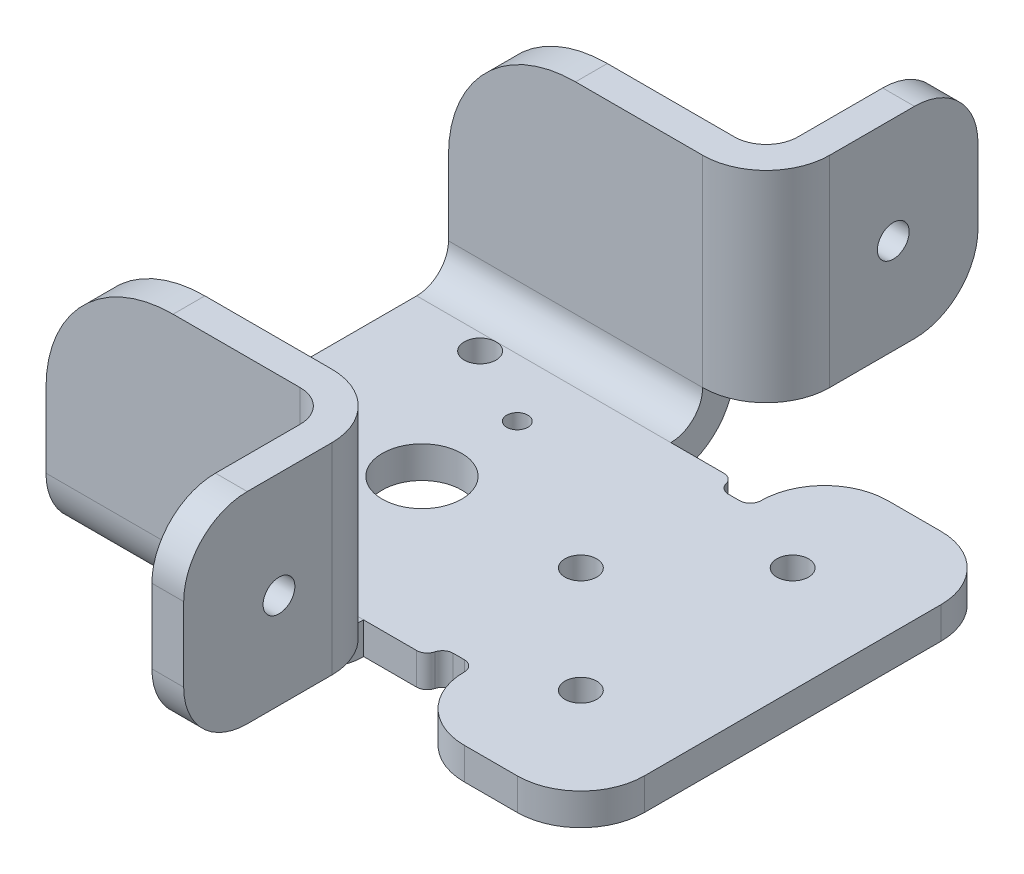
from build123d import *

# Parameters (mm, degrees)
BOSS_EXTRUDE1_DEPTH            = 3
SKETCH2_W                      = 24
SKETCH2_H                      = 3
BOSS_EXTRUDE2_DEPTH            = 6
SKETCH3_W                      = 24
SKETCH3_H                      = 3
BOSS_EXTRUDE3_DEPTH            = 22
SKETCH4_W                      = 3
SKETCH4_H                      = 19
BOSS_EXTRUDE4_DEPTH            = 6
SKETCH5_W                      = 3
SKETCH5_H                      = 19
BOSS_EXTRUDE5_DEPTH            = 17
SKETCH6_W                      = 24
SKETCH6_H                      = 3
BOSS_EXTRUDE6_DEPTH            = 6
SKETCH7_W                      = 24
SKETCH7_H                      = 3
BOSS_EXTRUDE7_DEPTH            = 22
SKETCH8_W                      = 3
SKETCH8_H                      = 19
BOSS_EXTRUDE8_DEPTH            = 6
SKETCH9_W                      = 3
SKETCH9_H                      = 19
BOSS_EXTRUDE9_DEPTH            = 17
F_2_0_2_DIAMETER_HOLE1_D       = 2
F_2_0_2_DIAMETER_HOLE1_DEPTH   = 25
F_7_5_7_5_DIAMETER_HOLE1_D     = 7.5
F_7_5_7_5_DIAMETER_HOLE1_DEPTH = 25
F_3_0_3_DIAMETER_HOLE1_D       = 3
F_3_0_3_DIAMETER_HOLE2_D       = 3
F_3_0_3_DIAMETER_HOLE2_DEPTH   = 23
FILLET1_R                      = 1
FILLET2_R                      = 3
FILLET3_R                      = 6
FILLET4_R                      = 12
HOLE1_D                        = 3
HOLE1_DEPTH                    = 3
HOLE1_TIP                      = 0.901290929


with BuildPart() as part:
    # Sketch1 → Boss-Extrude1 (new body)
    with BuildSketch(Plane(origin=(0, 3, 0), x_dir=(1, 0, 0), z_dir=(0, 1, 0))):
        with BuildLine():
            Line((-1, 14.5), (-30, 14.5))
            Line((-30, 14.5), (-30, -14.5))
            Line((-30, -14.5), (-1, -14.5))
            ThreePointArc((-1, -14.5), (-0.387627564, -14.290569415), (-0.031754163, -13.75))
            ThreePointArc((-0.031754163, -13.75), (0.324119237, -13.209430585), (0.936491673, -13))
            Line((0.936491673, -13), (3.083920217, -13))
            ThreePointArc((3.083920217, -13), (4.417424305, -17.872983346), (9, -20))
            Line((9, -20), (20, -20))
            Line((20, -20), (20, 20))
            Line((20, 20), (9, 20))
            ThreePointArc((9, 20), (4.417424305, 17.872983346), (3.083920217, 13))
            Line((3.083920217, 13), (0.936491673, 13))
            ThreePointArc((0.936491673, 13), (0.324119237, 13.209430585), (-0.031754163, 13.75))
            ThreePointArc((-0.031754163, 13.75), (-0.387627564, 14.290569415), (-1, 14.5))
        make_face()
    extrude(amount=-BOSS_EXTRUDE1_DEPTH)

    # Sketch2 → Boss-Extrude2 (add)
    with BuildSketch(Plane(origin=(0, 0, -14.5), x_dir=(-1, 0, 0), z_dir=(0, 0, -1))):
        with Locations((18, 1.5)):
            Rectangle(SKETCH2_W, SKETCH2_H)
    extrude(amount=BOSS_EXTRUDE2_DEPTH)

    # Sketch3 → Boss-Extrude3 (add)
    with BuildSketch(Plane(origin=(0, 3, 0), x_dir=(-1, 0, 0), z_dir=(0, 1, 0))):
        with Locations((18, -19)):
            Rectangle(SKETCH3_W, SKETCH3_H)
    extrude(amount=BOSS_EXTRUDE3_DEPTH)

    # Sketch4 → Boss-Extrude4 (add)
    with BuildSketch(Plane(origin=(-6, 0, 0), x_dir=(0, 0, -1), z_dir=(1, 0, 0))):
        with Locations((19, 15.5)):
            Rectangle(SKETCH4_W, SKETCH4_H)
    extrude(amount=BOSS_EXTRUDE4_DEPTH)

    # Sketch5 → Boss-Extrude5 (add)
    with BuildSketch(Plane(origin=(0, 0, -20.5), x_dir=(-1, 0, 0), z_dir=(0, 0, -1))):
        with Locations((1.5, 15.5)):
            Rectangle(SKETCH5_W, SKETCH5_H)
    extrude(amount=BOSS_EXTRUDE5_DEPTH)

    # Sketch6 → Boss-Extrude6 (add)
    with BuildSketch(Plane.XY.offset(14.5)):
        with Locations((-18, 1.5)):
            Rectangle(SKETCH6_W, SKETCH6_H)
    extrude(amount=BOSS_EXTRUDE6_DEPTH)

    # Sketch7 → Boss-Extrude7 (add)
    with BuildSketch(Plane(origin=(0, 3, 0), x_dir=(-1, 0, 0), z_dir=(0, 1, 0))):
        with Locations((18, 19)):
            Rectangle(SKETCH7_W, SKETCH7_H)
    extrude(amount=BOSS_EXTRUDE7_DEPTH)

    # Sketch8 → Boss-Extrude8 (add)
    with BuildSketch(Plane(origin=(-6, 0, 0), x_dir=(0, 0, -1), z_dir=(1, 0, 0))):
        with Locations((-19, 15.5)):
            Rectangle(SKETCH8_W, SKETCH8_H)
    extrude(amount=BOSS_EXTRUDE8_DEPTH)

    # Sketch9 → Boss-Extrude9 (add)
    with BuildSketch(Plane.XY.offset(20.5)):
        with Locations((-1.5, 15.5)):
            Rectangle(SKETCH9_W, SKETCH9_H)
    extrude(amount=BOSS_EXTRUDE9_DEPTH)

    # Ø2.0 (2) Diameter Hole1
    with Locations(Plane(origin=(0, 0, 0), x_dir=(-1, 0, 0), z_dir=(0, -1, 0))):
        with Locations((15, -9), (15, 9)):
            Hole(F_2_0_2_DIAMETER_HOLE1_D / 2, depth=F_2_0_2_DIAMETER_HOLE1_DEPTH)

    # Ø7.5 (7.5) Diameter Hole1
    with Locations(Plane(origin=(0, 0, 0), x_dir=(-1, 0, 0), z_dir=(0, -1, 0))):
        with Locations((15, 0)):
            Hole(F_7_5_7_5_DIAMETER_HOLE1_D / 2, depth=F_7_5_7_5_DIAMETER_HOLE1_DEPTH)

    # Ø3.0 (3) Diameter Hole1 (through all)
    with Locations(Plane(origin=(0, 3, 0), x_dir=(1, 0, 0), z_dir=(0, 1, 0))):
        with Locations((10, -10), (10, 10)):
            Hole(F_3_0_3_DIAMETER_HOLE1_D / 2)

    # Ø3.0 (3) Diameter Hole2
    with Locations(Plane.ZY.offset(3)):
        with Locations((28.5, 15), (-29.5, 15)):
            Hole(F_3_0_3_DIAMETER_HOLE2_D / 2, depth=F_3_0_3_DIAMETER_HOLE2_DEPTH)

    # Fillet1
    fillet1_edges = [part.edges().sort_by_distance(p)[0] for p in [
        (3.083920217, 1.5, -13),
        (3.083920217, 1.5, 13),
    ]]
    fillet(fillet1_edges, radius=FILLET1_R)

    # Fillet2
    fillet2_edges = [part.edges().sort_by_distance(p)[0] for p in [
        (-18, 3, -17.5),
        (-3, 15.5, 20.5),
        (-18, 3, 17.5),
        (-3, 15.5, -20.5),
    ]]
    fillet(fillet2_edges, radius=FILLET2_R)

    # Fillet3
    fillet3_edges = [part.edges().sort_by_distance(p)[0] for p in [
        (0, 15.5, 17.5),
        (20, 1.5, -20),
        (-18, 0, 20.5),
        (-18, 0, -20.5),
        (-1.5, 25, 37.5),
        (20, 1.5, 20),
        (0, 15.5, -17.5),
        (-1.5, 6, -37.5),
        (-1.5, 6, 37.5),
        (-1.5, 25, -37.5),
    ]]
    fillet(fillet3_edges, radius=FILLET3_R)

    # Fillet4
    fillet4_edges = [part.edges().sort_by_distance(p)[0] for p in [
        (-30, 25, 19),
        (-30, 25, -19),
    ]]
    fillet(fillet4_edges, radius=FILLET4_R)

    # Hole1
    with Locations(Plane(origin=(0, 0, 0), x_dir=(-1, 0, 0), z_dir=(0, -1, 0))):
        with Locations((0, 0), (22.5, -12.990381057), (22.5, 12.990381057)):
            Hole(HOLE1_D / 2, depth=HOLE1_DEPTH)
            with Locations((0, 0, -(HOLE1_DEPTH + HOLE1_TIP / 2))):  # 118° drill point
                Cone(0, HOLE1_D / 2, HOLE1_TIP, mode=Mode.SUBTRACT)


solid = part.part
